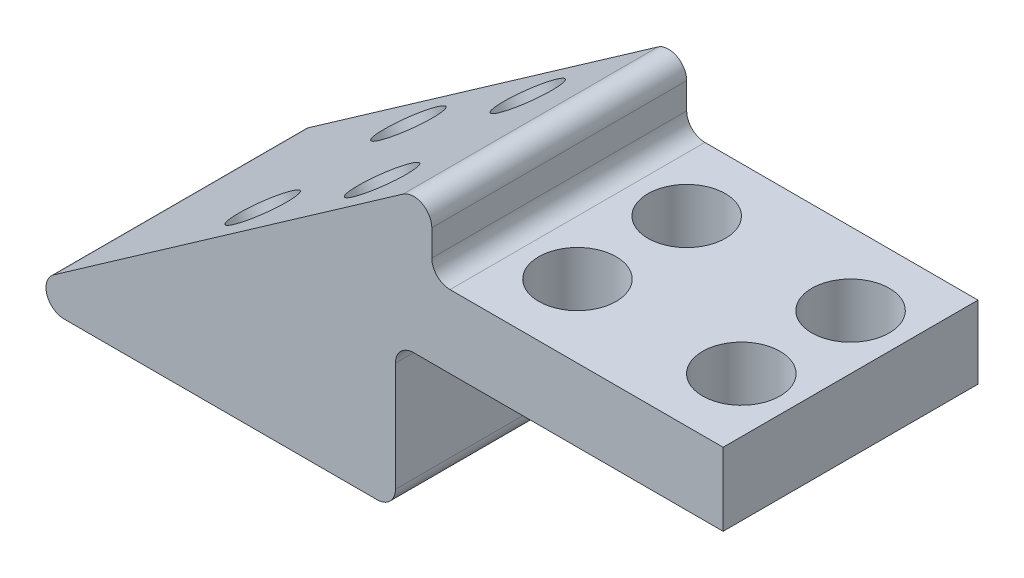
from build123d import *

# Parameters (mm, degrees)
BOSS_EXTRUDE1_DEPTH             = 11.1125
F_1_4_CLEARANCE_HOLE1_D         = 6.7564
FILLET1_R                       = 1.5875
TAP_DRILL_FOR_1_4_20_TAP1_D     = 5.1054
TAP_DRILL_FOR_1_4_20_TAP1_DEPTH = 9.525
TAP_DRILL_FOR_1_4_20_TAP1_TIP   = 1.533816902


with BuildPart() as part:
    # Sketch1 → Boss-Extrude1 (new, symmetric)
    with BuildSketch(Plane.XY):
        Polygon((0, 0), (25.4, 0), (25.4, 6.35), (0, 6.35), (0, 13.269040681), (-37.087633685, -12.7), (-3.175, -12.7), (-3.175, 0), align=None)
    extrude(amount=BOSS_EXTRUDE1_DEPTH, both=True)

    # 1/4 Clearance Hole1 (through all)
    with Locations(Plane(origin=(0, 6.35, 0), x_dir=(1, 0, 0), z_dir=(0, 1, 0))):
        with Locations((6.35, 4.7625), (20.6375, 4.7625), (6.35, -4.7625), (20.6375, -4.7625)):
            Hole(F_1_4_CLEARANCE_HOLE1_D / 2)

    # Fillet1
    fillet1_edges = [part.edges().sort_by_distance(p)[0] for p in [
        (-3.175, 0, 0),
        (-3.175, -12.7, 0),
        (-37.087633685, -12.7, 0),
        (0, 13.269040681, 0),
        (0, 6.35, 0),
    ]]
    fillet(fillet1_edges, radius=FILLET1_R)

    # Tap Drill for 1/4-20 Tap1
    with Locations(Plane(origin=(-6.234409806, 8.903659938, 0), x_dir=(0.8191520442889947, 0.5735764363510422, 0), z_dir=(-0.573576436351042, 0.8191520442889946, 0))):
        with Locations((-16.201690933, 6.35), (-3.501690933, 6.35), (-3.501690933, -6.35), (-16.201690933, -6.35)):
            Hole(TAP_DRILL_FOR_1_4_20_TAP1_D / 2, depth=TAP_DRILL_FOR_1_4_20_TAP1_DEPTH)
            with Locations((0, 0, -(TAP_DRILL_FOR_1_4_20_TAP1_DEPTH + TAP_DRILL_FOR_1_4_20_TAP1_TIP / 2))):  # 118° drill point
                Cone(0, TAP_DRILL_FOR_1_4_20_TAP1_D / 2, TAP_DRILL_FOR_1_4_20_TAP1_TIP, mode=Mode.SUBTRACT)


solid = part.part
